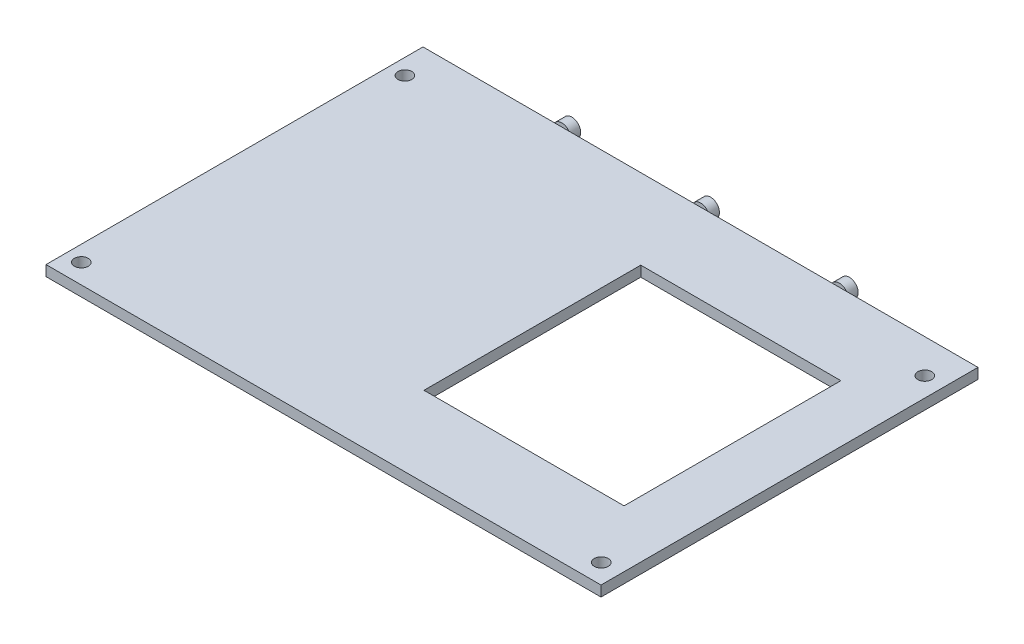
from build123d import *

# Parameters (mm, degrees)
SKETCH2_W           = 106
SKETCH2_H           = 2
BOSS_EXTRUDE1_DEPTH = 72
SKETCH4_R           = 1.325
CUT_EXTRUDE1_DEPTH  = 90.425947018
SKETCH6_W           = 38.22100301
SKETCH6_H           = 41.408309334
CUT_EXTRUDE3_DEPTH  = 10
SKETCH5_R           = 1.7
BOSS_EXTRUDE2_DEPTH = 1.92


with BuildPart() as part:
    # Sketch2 → Boss-Extrude1 (new body)
    with BuildSketch(Plane.XY):
        Rectangle(SKETCH2_W, SKETCH2_H)
    extrude(amount=BOSS_EXTRUDE1_DEPTH)

    # Sketch4 → Cut-Extrude1 (cut, through all)
    with BuildSketch(Plane(origin=(0, 1, 0), x_dir=(1, 0, 0), z_dir=(0, 1, 0))):
        with Locations(Location((-50.004878073, -6.450693227, 0), (0, 0, 270))):
            Circle(SKETCH4_R)
        with Locations(Location((-50.004878073, -68.250693227, 0), (0, 0, 270))):
            Circle(SKETCH4_R)
        with Locations(Location((49.295121927, -68.250693227, 0), (0, 0, 270))):
            Circle(SKETCH4_R)
        with Locations(Location((49.295121927, -6.450693227, 0), (0, 0, 270))):
            Circle(SKETCH4_R)
    extrude(amount=-CUT_EXTRUDE1_DEPTH, mode=Mode.SUBTRACT)

    # Sketch6 → Cut-Extrude3 (cut)
    with BuildSketch(Plane(origin=(0, 1, 0), x_dir=(1, 0, 0), z_dir=(0, 1, 0))):
        with Locations((23, -36)):
            Rectangle(SKETCH6_W, SKETCH6_H)
    extrude(amount=-CUT_EXTRUDE3_DEPTH, mode=Mode.SUBTRACT)

    # Sketch5 → Boss-Extrude2 (add)
    with BuildSketch(Plane(origin=(0, 0, 0), x_dir=(-1, 0, 0), z_dir=(0, 0, -1))):
        with Locations(Location((0, 0, 0), (0, 0, 216.031879072))):
            Circle(SKETCH5_R)
        with Locations(Location((26.5, 0, 0), (0, 0, 143.968120928))):
            Circle(SKETCH5_R)
        with Locations(Location((-26.5, 0, 0), (0, 0, 143.968120928))):
            Circle(SKETCH5_R)
    extrude(amount=BOSS_EXTRUDE2_DEPTH)


solid = part.part
